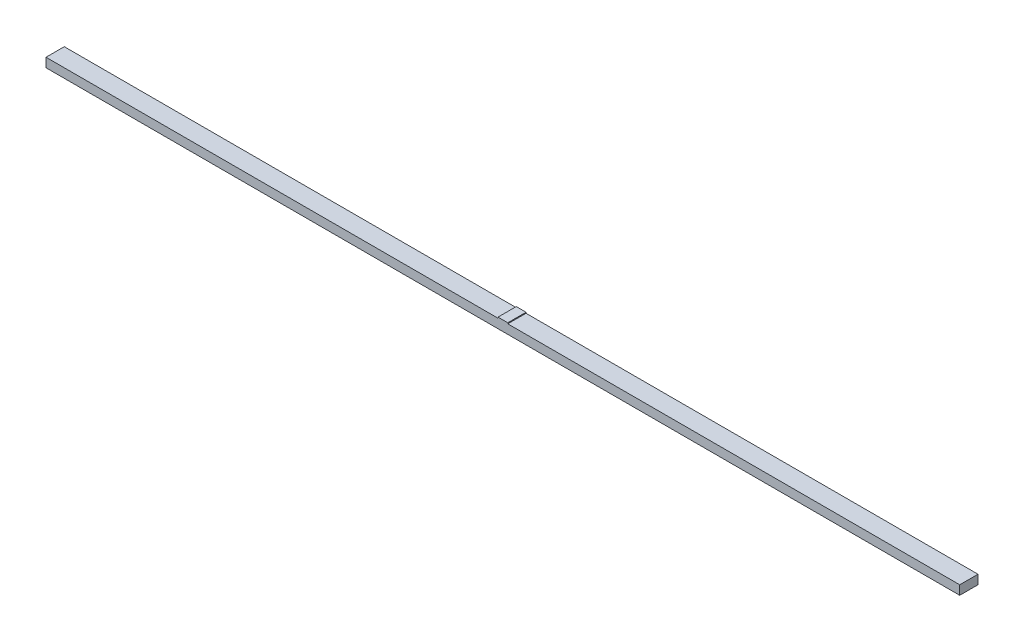
from build123d import *

# Parameters (mm, degrees)
SKETCH2_W           = 1000
SKETCH2_H           = 10
EXTRUDE_THIN1_DEPTH = 20
SKETCH4_W           = 10.725253094
SKETCH4_H           = 20
BOSS_EXTRUDE1_DEPTH = 1


with BuildPart() as part:
    # Sketch2 → Extrude-Thin1 (new body)
    with BuildSketch(Plane.XY):
        with Locations((0, 5)):
            Rectangle(SKETCH2_W, SKETCH2_H)
    extrude(amount=EXTRUDE_THIN1_DEPTH)

    # Sketch4 → Boss-Extrude1 (add)
    with BuildSketch(Plane(origin=(0, 10, 0), x_dir=(1, 0, 0), z_dir=(0, 1, 0))):
        with Locations((0, -10)):
            Rectangle(SKETCH4_W, SKETCH4_H)
    extrude(amount=BOSS_EXTRUDE1_DEPTH)


solid = part.part
